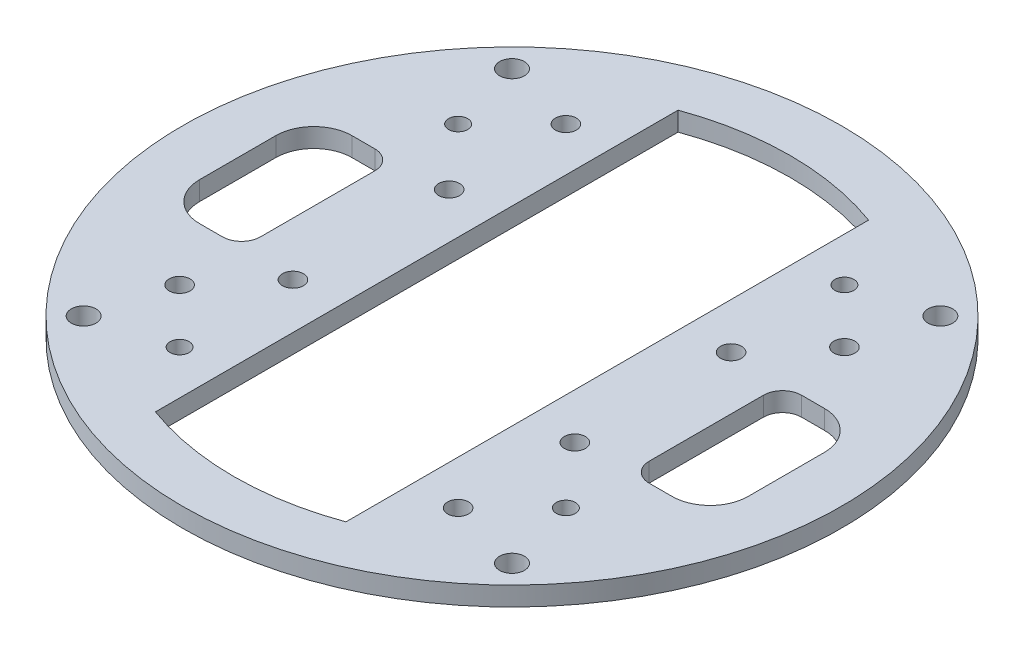
from build123d import *

# Parameters (mm, degrees)
SKETCH1_R           = 3.25
SKETCH1_R_2         = 2.75
SKETCH1_W           = 21
SKETCH1_H           = 40
BOSS_EXTRUDE1_DEPTH = 5
FILLET1_R           = 10
FILLET3_R           = 5
SKETCH3_R           = 2.75
SKETCH3_R_2         = 2.5
CUT_EXTRUDE1_DEPTH  = 10


with BuildPart() as part:
    # Sketch1 → Boss-Extrude1 (new body)
    with BuildSketch(Plane(origin=(0, 0, 0), x_dir=(1, 0, 0), z_dir=(0, 1, 0))):
        with BuildLine():
            ThreePointArc((0, 86.5), (-86.5, 0), (0, -86.5))
            ThreePointArc((0, -86.5), (86.5, 0), (0, 86.5))
        make_face()
        with Locations(Location((-56.214989104, -56.214989104, 0), (0, 0, 270))):
            Circle(SKETCH1_R, mode=Mode.SUBTRACT)
        with Locations(Location((-37, -20.5, 0), (0, 0, 270))):
            Circle(SKETCH1_R_2, mode=Mode.SUBTRACT)
        with Locations(Location((56.214989104, -56.214989104, 0), (0, 0, 270))):
            Circle(SKETCH1_R, mode=Mode.SUBTRACT)
        with Locations(Location((37, -20.5, 0), (0, 0, 270))):
            Circle(SKETCH1_R_2, mode=Mode.SUBTRACT)
        with Locations((-61.5, 0)):
            Rectangle(SKETCH1_W, SKETCH1_H, mode=Mode.SUBTRACT)
        with Locations(Location((-37, 20.5, 0), (0, 0, 270))):
            Circle(SKETCH1_R_2, mode=Mode.SUBTRACT)
        with Locations(Location((-56.214989104, 56.214989104, 0), (0, 0, 270))):
            Circle(SKETCH1_R, mode=Mode.SUBTRACT)
        with BuildLine():
            ThreePointArc((-25, 68.585712798), (0, 73), (25, 68.585712798))
            Line((25, 68.585712798), (25, 20))
            Line((25, 20), (25, -20))
            Line((25, -20), (25, -68.585712798))
            ThreePointArc((25, -68.585712798), (0, -73), (-25, -68.585712798))
            Line((-25, -68.585712798), (-25, -20))
            Line((-25, -20), (-25, 20))
            Line((-25, 20), (-25, 68.585712798))
        make_face(mode=Mode.SUBTRACT)
        with Locations(Location((37, 20.5, 0), (0, 0, 270))):
            Circle(SKETCH1_R_2, mode=Mode.SUBTRACT)
        with Locations((61.5, 0)):
            Rectangle(SKETCH1_W, SKETCH1_H, mode=Mode.SUBTRACT)
        with Locations(Location((56.214989104, 56.214989104, 0), (0, 0, 270))):
            Circle(SKETCH1_R, mode=Mode.SUBTRACT)
    extrude(amount=BOSS_EXTRUDE1_DEPTH)

    # Fillet1
    fillet1_edges = [part.edges().sort_by_distance(p)[0] for p in [
        (72, 2.5, 20),
        (72, 2.5, -20),
        (-72, 2.5, -20),
        (-72, 2.5, 20),
    ]]
    fillet(fillet1_edges, radius=FILLET1_R)

    # Fillet3
    fillet3_edges = [part.edges().sort_by_distance(p)[0] for p in [
        (51, 2.5, -20),
        (51, 2.5, 20),
        (-51, 2.5, -20),
        (-51, 2.5, 20),
    ]]
    fillet(fillet3_edges, radius=FILLET3_R)

    # Sketch3 → Cut-Extrude1 (cut)
    with BuildSketch(Plane(origin=(0, 5, 0), x_dir=(1, 0, 0), z_dir=(0, 1, 0))):
        with Locations(Location((-50.695888728, -36.553753105, 0), (0, 0, 270))):
            Circle(SKETCH3_R)
        with Locations(Location((-36.553753105, -50.695888728, 0), (0, 0, 270))):
            Circle(SKETCH3_R_2)
        with Locations(Location((-36.553753105, 50.695888728, 0), (0, 0, 270))):
            Circle(SKETCH3_R)
        with Locations(Location((-50.695888728, 36.553753105, 0), (0, 0, 270))):
            Circle(SKETCH3_R_2)
        with Locations(Location((50.695888728, 36.553753105, 0), (0, 0, 270))):
            Circle(SKETCH3_R)
        with Locations(Location((36.553753105, 50.695888728, 0), (0, 0, 270))):
            Circle(SKETCH3_R_2)
        with Locations(Location((36.553753105, -50.695888728, 0), (0, 0, 270))):
            Circle(SKETCH3_R)
        with Locations(Location((50.695888728, -36.553753105, 0), (0, 0, 270))):
            Circle(SKETCH3_R_2)
    extrude(amount=-CUT_EXTRUDE1_DEPTH, mode=Mode.SUBTRACT)


solid = part.part
